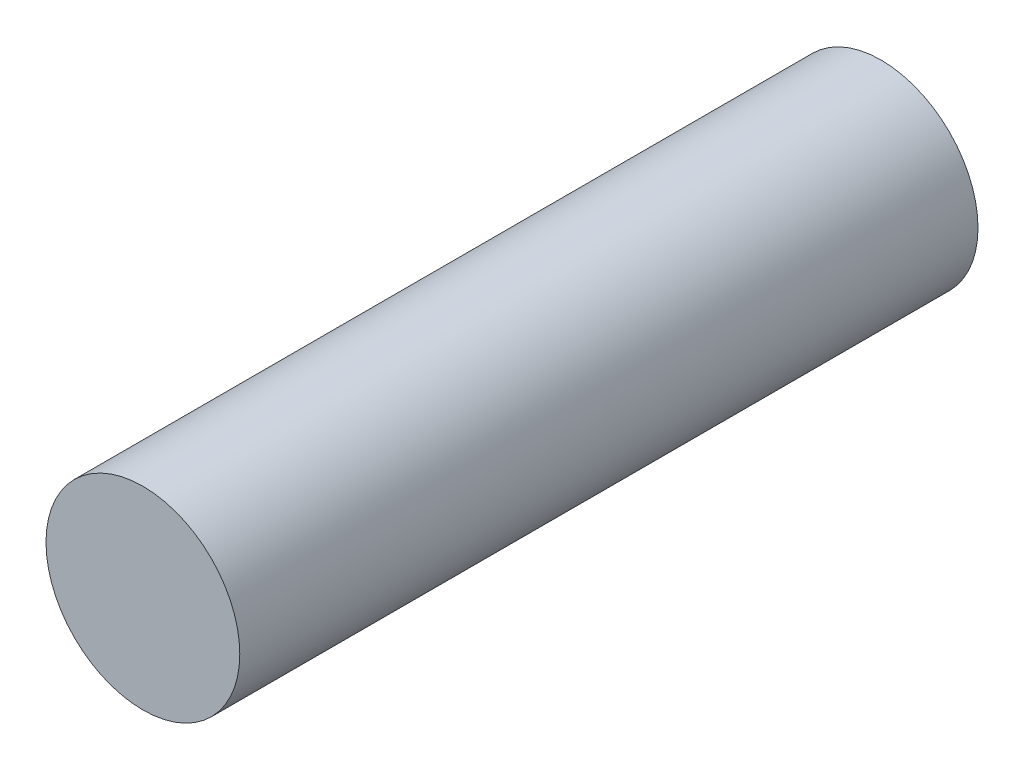
from build123d import *

# Parameters (mm, degrees)
SKETCH1_R           = 5.25
BOSS_EXTRUDE1_DEPTH = 40


with BuildPart() as part:
    # Sketch1 → Boss-Extrude1 (new body)
    with BuildSketch(Plane.XY):
        Circle(SKETCH1_R)
    extrude(amount=BOSS_EXTRUDE1_DEPTH)


solid = part.part
